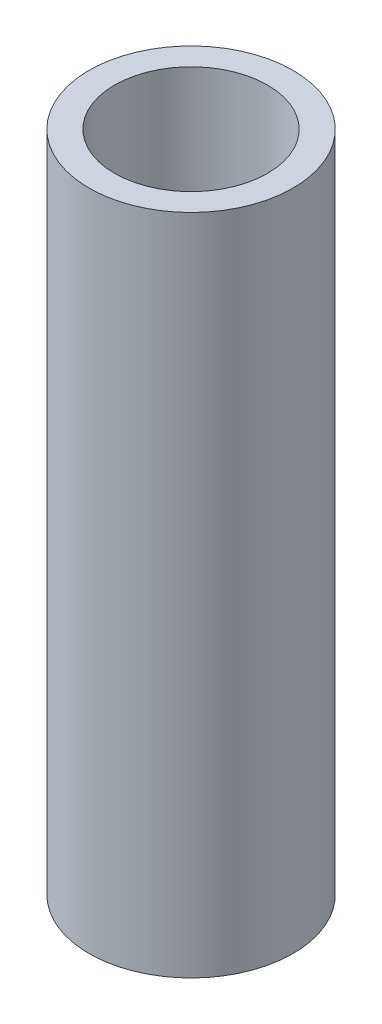
from build123d import *

# Parameters (mm, degrees)
SKETCH1_R           = 4
SKETCH1_R_2         = 3
BOSS_EXTRUDE1_DEPTH = 26


with BuildPart() as part:
    # Sketch1 → Boss-Extrude1 (new body)
    with BuildSketch(Plane(origin=(0, 0, 0), x_dir=(1, 0, 0), z_dir=(0, 1, 0))):
        with Locations(Location((0, 0, 0), (0, 0, 90))):
            Circle(SKETCH1_R)
        with Locations(Location((0, 0, 0), (0, 0, 90))):
            Circle(SKETCH1_R_2, mode=Mode.SUBTRACT)
    extrude(amount=BOSS_EXTRUDE1_DEPTH)


solid = part.part
